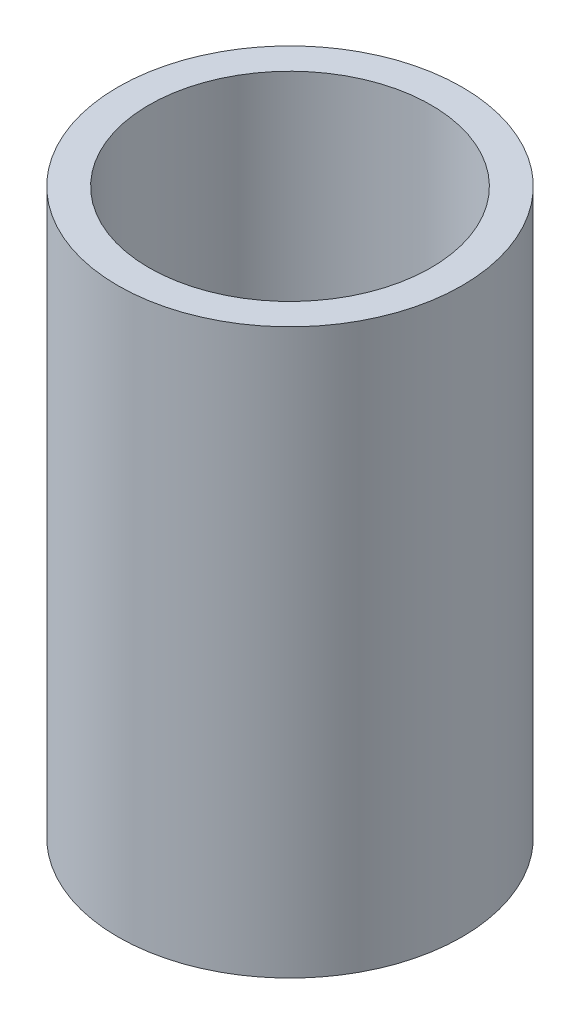
from build123d import *

# Parameters (mm, degrees)
SKETCH1_R           = 3.05
SKETCH1_R_2         = 2.5
BOSS_EXTRUDE1_DEPTH = 9.5
BOSS_EXTRUDE2_START = 0.5
SKETCH2_R           = 3.05
BOSS_EXTRUDE2_DEPTH = 0.5


with BuildPart() as part:
    # Sketch1 → Boss-Extrude1 (new body)
    with BuildSketch(Plane(origin=(0, 0, 0), x_dir=(1, 0, 0), z_dir=(0, 1, 0))):
        with Locations(Location((0, 0, 0), (0, 0, 270))):
            Circle(SKETCH1_R)
        with Locations(Location((0, 0, 0), (0, 0, 270))):
            Circle(SKETCH1_R_2, mode=Mode.SUBTRACT)
    extrude(amount=BOSS_EXTRUDE1_DEPTH)

    # Sketch2 → Boss-Extrude2 (add)
    with BuildSketch(Plane.XZ.offset(BOSS_EXTRUDE2_START)):
        with Locations(Location((0, 0, 0), (0, 0, 270))):
            Circle(SKETCH2_R)
    extrude(amount=-BOSS_EXTRUDE2_DEPTH)


solid = part.part
